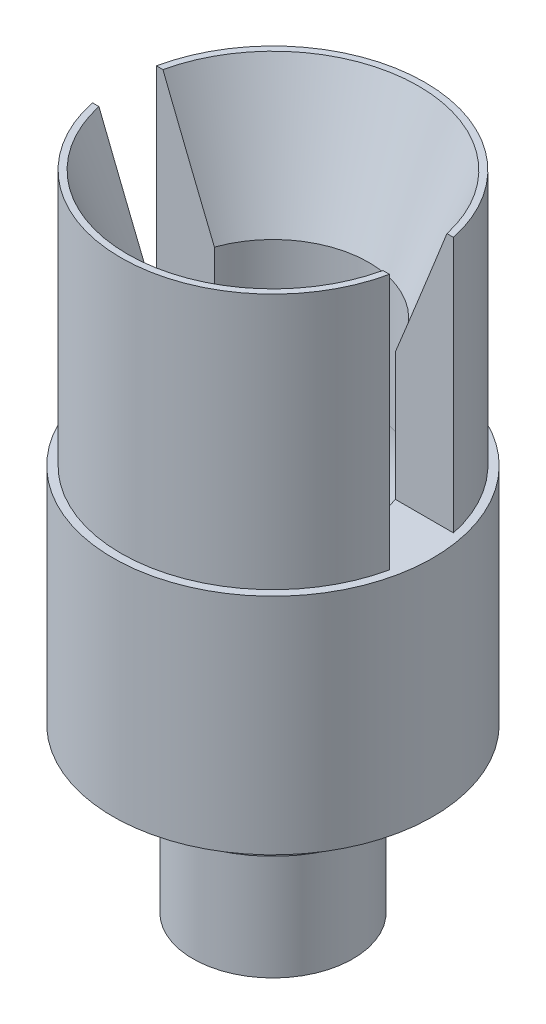
from build123d import *

# Parameters (mm, degrees)
ENL_V_MAT_EXTRU_1_REACH             = 23.308
ESQUISSE2_W                         = 2
ESQUISSE2_H                         = 8
ENL_V_MAT_EXTRU_1_DIRECTION_2_REACH = 23.308


with BuildPart() as part:
    # Esquisse1 → Révolution1 (revolve)
    with BuildSketch(Plane.XY, mode=Mode.PRIVATE) as r_volution1_sk:
        with BuildLine():
            Line((0, 0), (-2.5, 0))
            Line((-2.5, 0), (-2.5, 4))
            Line((-2.5, 4), (-3.5, 4))
            Line((-3.5, 4), (-3.5, 5.1))
            Line((-3.5, 5.1), (-5, 5.1))
            Line((-5, 5.1), (-5, 12.1))
            Line((-5, 12.1), (-4.75, 12.1))
            Line((-4.75, 12.1), (-4.75, 20.1))
            Line((-4.75, 20.1), (-4.55, 20.1))
            Line((-4.55, 20.1), (-3, 16.1))
            Line((-3, 16.1), (-3, 12.1))
            ThreePointArc((-3, 12.1), (-2.121320344, 9.978679656), (0, 9.1))
            Line((0, 9.1), (0, 0))
        make_face()
    revolve(r_volution1_sk.sketch.rotate(Axis((0, -1.292585524, 0), (0, 1, 0)), 270), axis=Axis((0, -1.292585524, 0), (0, 1, 0)))

    # Esquisse2 → Enlèv. mat.-Extru.1 (cut, up to next)
    with BuildSketch(Plane(origin=(0, 0, 0), x_dir=(0, 0, -1), z_dir=(1, 0, 0)), mode=Mode.PRIVATE) as enl_v_mat_extru_1_sk1:
        with Locations((0, 16.1)):
            Rectangle(ESQUISSE2_W, ESQUISSE2_H)
    enl_v_mat_extru_1_tool1 = extrude(enl_v_mat_extru_1_sk1.sketch, amount=-ENL_V_MAT_EXTRU_1_REACH, mode=Mode.PRIVATE) & part.part
    add(enl_v_mat_extru_1_tool1.solids().sort_by_distance((0, 16.1, 0))[0], mode=Mode.SUBTRACT)

    # Esquisse2 → Enlèv. mat.-Extru.1 direction 2 (cut, up to next)
    with BuildSketch(Plane(origin=(0, 0, 0), x_dir=(0, 0, -1), z_dir=(1, 0, 0)), mode=Mode.PRIVATE) as enl_v_mat_extru_1_direction_2_sk1:
        with Locations((0, 16.1)):
            Rectangle(ESQUISSE2_W, ESQUISSE2_H)
    enl_v_mat_extru_1_direction_2_tool1 = extrude(enl_v_mat_extru_1_direction_2_sk1.sketch, amount=ENL_V_MAT_EXTRU_1_DIRECTION_2_REACH, mode=Mode.PRIVATE) & part.part
    add(enl_v_mat_extru_1_direction_2_tool1.solids().sort_by_distance((0, 16.1, 0))[0], mode=Mode.SUBTRACT)


solid = part.part
